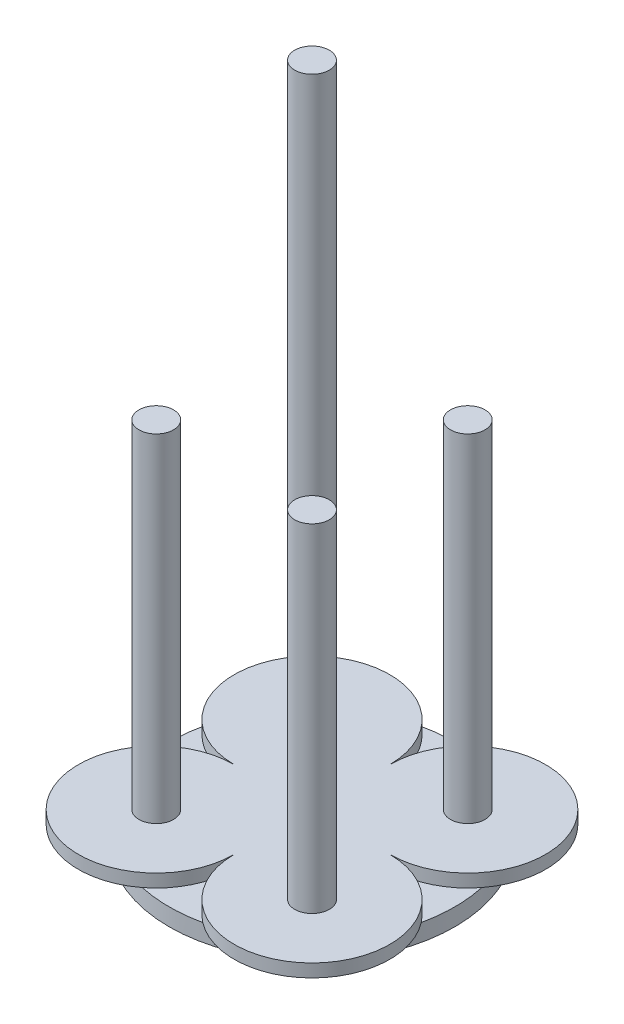
from build123d import *

# Parameters (mm, degrees)
SKETCH1_R           = 33
BOSS_EXTRUDE1_DEPTH = 4
BOSS_EXTRUDE2_DEPTH = 3
SKETCH3_R           = 4
BOSS_EXTRUDE3_DEPTH = 78
SKETCH4_R           = 4
BOSS_EXTRUDE4_DEPTH = 150


with BuildPart() as part:
    # Sketch1 → Boss-Extrude1 (new body)
    with BuildSketch(Plane(origin=(0, 0, 0), x_dir=(1, 0, 0), z_dir=(0, 1, 0))):
        with Locations(Location((0, 0, 0), (0, 0, 270))):
            Circle(SKETCH1_R)
    extrude(amount=BOSS_EXTRUDE1_DEPTH)

    # Sketch2 → Boss-Extrude2 (add)
    with BuildSketch(Plane(origin=(0, 4, 0), x_dir=(1, 0, 0), z_dir=(0, 1, 0))):
        with BuildLine():
            ThreePointArc((18, 0), (30.727922061, 30.727922061), (0, 18))
            ThreePointArc((0, 18), (-30.727922061, 30.727922061), (-18, 0))
            ThreePointArc((-18, 0), (-30.727922061, -30.727922061), (0, -18))
            ThreePointArc((0, -18), (30.727922061, -30.727922061), (18, 0))
        make_face()
    extrude(amount=BOSS_EXTRUDE2_DEPTH)

    # Sketch3 → Boss-Extrude3 (add)
    with BuildSketch(Plane(origin=(0, 7, 0), x_dir=(1, 0, 0), z_dir=(0, 1, 0))):
        with Locations(Location((-18, 18, 0), (0, 0, 270))):
            Circle(SKETCH3_R)
        with Locations(Location((18, 18, 0), (0, 0, 270))):
            Circle(SKETCH3_R)
        with Locations(Location((18, -18, 0), (0, 0, 270))):
            Circle(SKETCH3_R)
        with Locations(Location((-18, -18, 0), (0, 0, 270))):
            Circle(SKETCH3_R)
    extrude(amount=BOSS_EXTRUDE3_DEPTH)

    # Sketch4 → Boss-Extrude4 (add)
    with BuildSketch(Plane(origin=(0, 7, 0), x_dir=(1, 0, 0), z_dir=(0, 1, 0))):
        with Locations(Location((0, 0, 0), (0, 0, 270))):
            Circle(SKETCH4_R)
    extrude(amount=BOSS_EXTRUDE4_DEPTH)


solid = part.part
